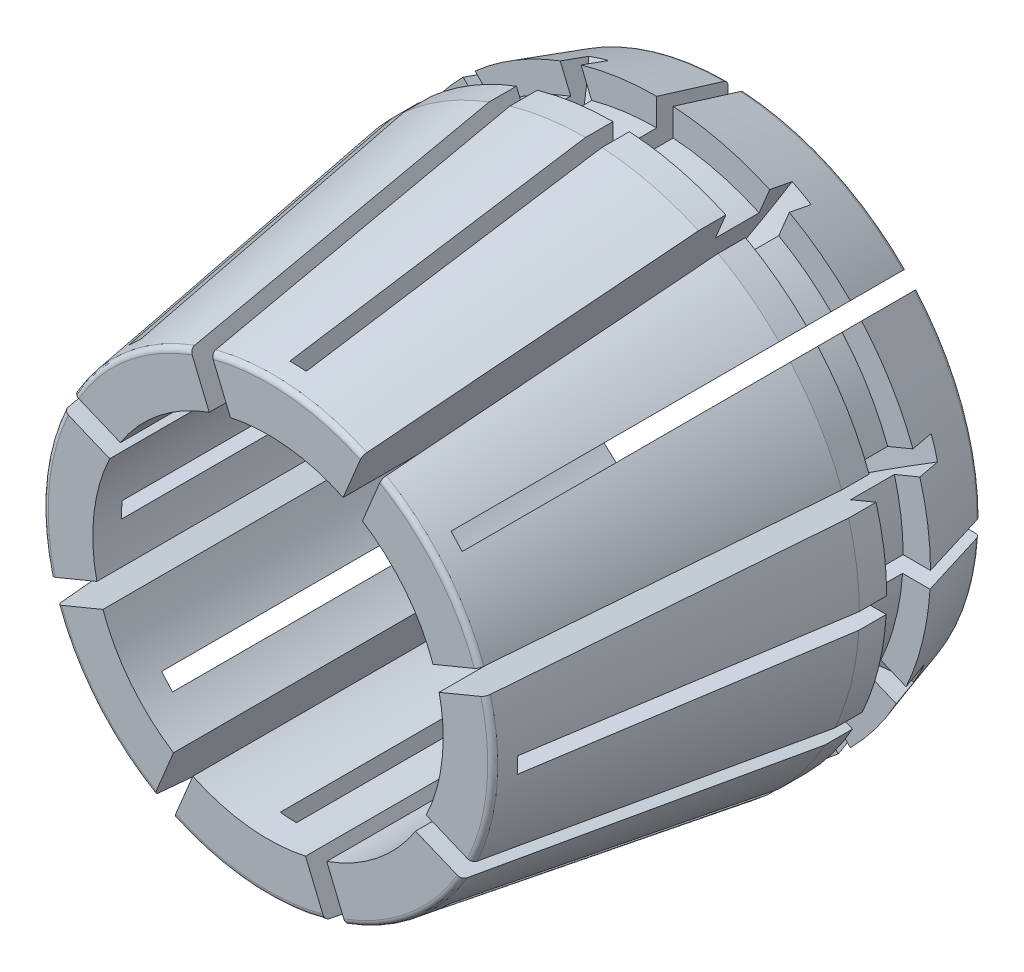
from build123d import *

# Parameters (mm, degrees)
FILLET1_R          = 0.5
FILLET2_R          = 0.5
CUT_EXTRUDE1_DEPTH = 1.5
CIRPATTERN1_COUNT  = 8
CUT_EXTRUDE3_DEPTH = 2
CIRPATTERN2_COUNT  = 8


with BuildPart() as part:
    # Sketch1 → Revolve1 (revolve)
    with BuildSketch(Plane(origin=(0, 0, 0), x_dir=(1, 0, 0), z_dir=(0, 1, 0))):
        Polygon((23, 100), (16, 100), (16, 58), (20.5, 58), (25, 87), (25, 89.5), (22.5, 89.5), (22.5, 93.5), (25, 93.5), align=None)
    revolve(axis=Axis((0, 0, -58), (0, 0, -1)))

    # Fillet1
    fillet1_edges = [part.edges().sort_by_distance(p)[0] for p in [
        (-23, 0, -100),
    ]]
    fillet(fillet1_edges, radius=FILLET1_R)

    # Fillet2
    fillet2_edges = [part.edges().sort_by_distance(p)[0] for p in [
        (-20.5, 0, -58),
    ]]
    fillet(fillet2_edges, radius=FILLET2_R)

    # Sketch2 → Cut-Extrude1 (cut)
    with BuildSketch(Plane(origin=(0, 0, 0), x_dir=(0, 0, -1), z_dir=(1, 0, 0))):
        with BuildLine():
            Line((81, 0), (102, 0))
            Line((102, 0), (102, -21))
            ThreePointArc((102, -21), (66.150757595, -35.849242405), (81, 0))
        make_face()
    cut_extrude1 = extrude(amount=-CUT_EXTRUDE1_DEPTH, mode=Mode.SUBTRACT)

    # CirPattern1: Cut-Extrude1 ×8 about axis
    cirpattern1_axis = Axis((0, 0, 0), (0, 0, 1))
    for i in range(1, CIRPATTERN1_COUNT):
        add(cut_extrude1.rotate(cirpattern1_axis, i * 360 / CIRPATTERN1_COUNT), mode=Mode.SUBTRACT)

    # Sketch4 → Cut-Extrude3 (cut)
    with BuildSketch(Plane(origin=(0.310660172, -0.75, 0), x_dir=(0.9238795325112851, 0.3826834323650939, 0), z_dir=(-0.3826834323650939, 0.9238795325112851, 0))):
        with BuildLine():
            Line((0, 14.651559068), (42.674220466, 14.651559068))
            ThreePointArc((42.674220466, 14.651559068), (84.079576898, 67.654649325), (22.630712673, 95))
            ThreePointArc((22.630712673, 95), (6.092598284, 79.300173973), (0, 57.325779534))
            Line((0, 57.325779534), (0, 14.651559068))
        make_face()
    cut_extrude3 = extrude(amount=-CUT_EXTRUDE3_DEPTH, mode=Mode.SUBTRACT)

    # CirPattern2: Cut-Extrude3 ×8 about axis
    cirpattern2_axis = Axis((0, 0, 0), (0, 0, 1))
    for i in range(1, CIRPATTERN2_COUNT):
        add(cut_extrude3.rotate(cirpattern2_axis, i * 360 / CIRPATTERN2_COUNT), mode=Mode.SUBTRACT)


solid = part.part
